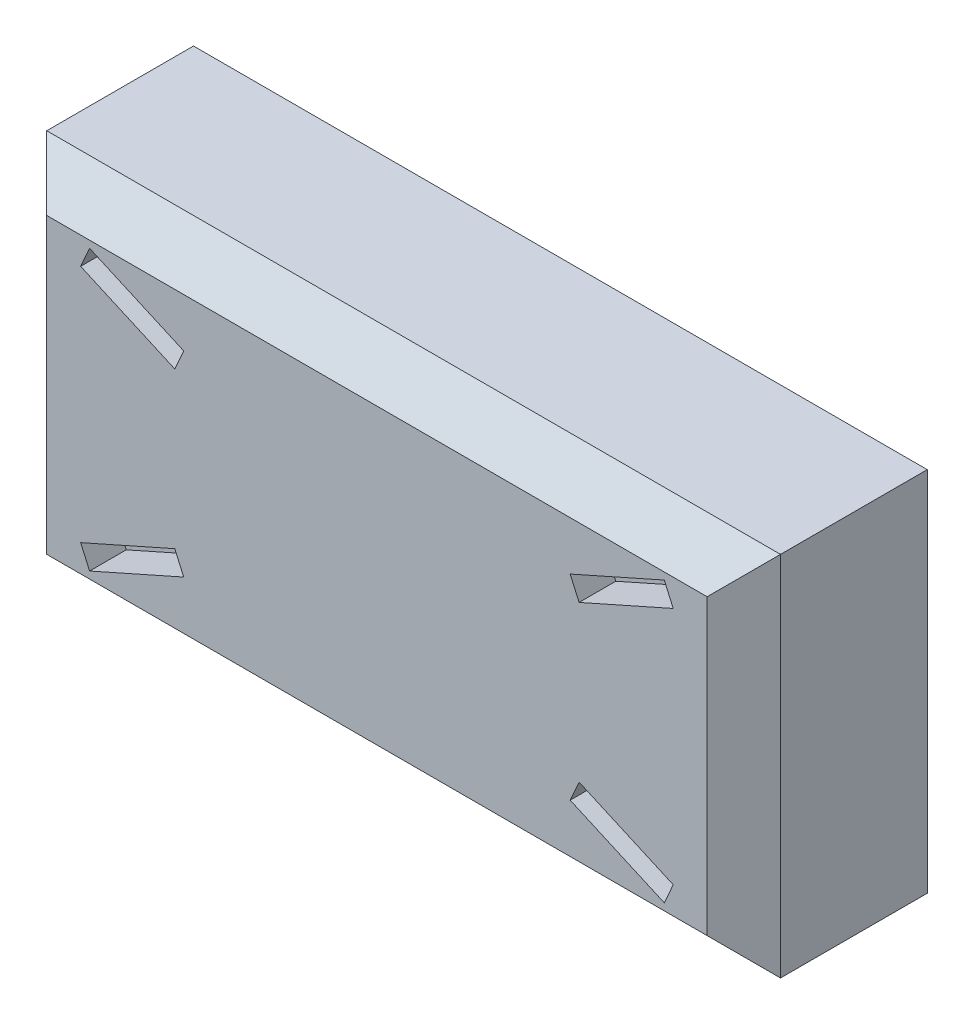
from build123d import *

# Parameters (mm, degrees)
SKETCH_1_W          = 20
SKETCH_1_H          = 10
EXTRUDE_1_DEPTH     = 5
CHAMFER_1_SIZE      = 1
CUT_EXTRUDE_1_DEPTH = 1


with BuildPart() as part:
    # 草图1 → 凸台-拉伸1 (new body)
    with BuildSketch(Plane.XY):
        Rectangle(SKETCH_1_W, SKETCH_1_H)
    extrude(amount=EXTRUDE_1_DEPTH)

    # 倒角1
    chamfer_1_edges = [part.edges().sort_by_distance(p)[0] for p in [
        (-10, 0, 5),
        (0, -5, 5),
        (10, 0, 5),
        (0, 5, 5),
    ]]
    chamfer(chamfer_1_edges, length=CHAMFER_1_SIZE)

    # 草图2 → 切除-拉伸1 (cut)
    with BuildSketch(Plane.XY.offset(5)):
        Polygon((-5.266489436, -2.668957232), (-5.510172516, -2.120670303), (-8.075856157, -3.260974143), (-7.832173078, -3.809261072), align=None)
        Polygon((-5.266489436, 2.668957232), (-7.832173078, 3.809261072), (-8.075856157, 3.260974143), (-5.510172516, 2.120670303), align=None)
        Polygon((5.266489436, 2.668957232), (5.510172516, 2.120670303), (8.075856157, 3.260974143), (7.832173078, 3.809261072), align=None)
        Polygon((5.266489436, -2.668957232), (7.832173078, -3.809261072), (8.075856157, -3.260974143), (5.510172516, -2.120670303), align=None)
    extrude(amount=-CUT_EXTRUDE_1_DEPTH, mode=Mode.SUBTRACT)


solid = part.part
